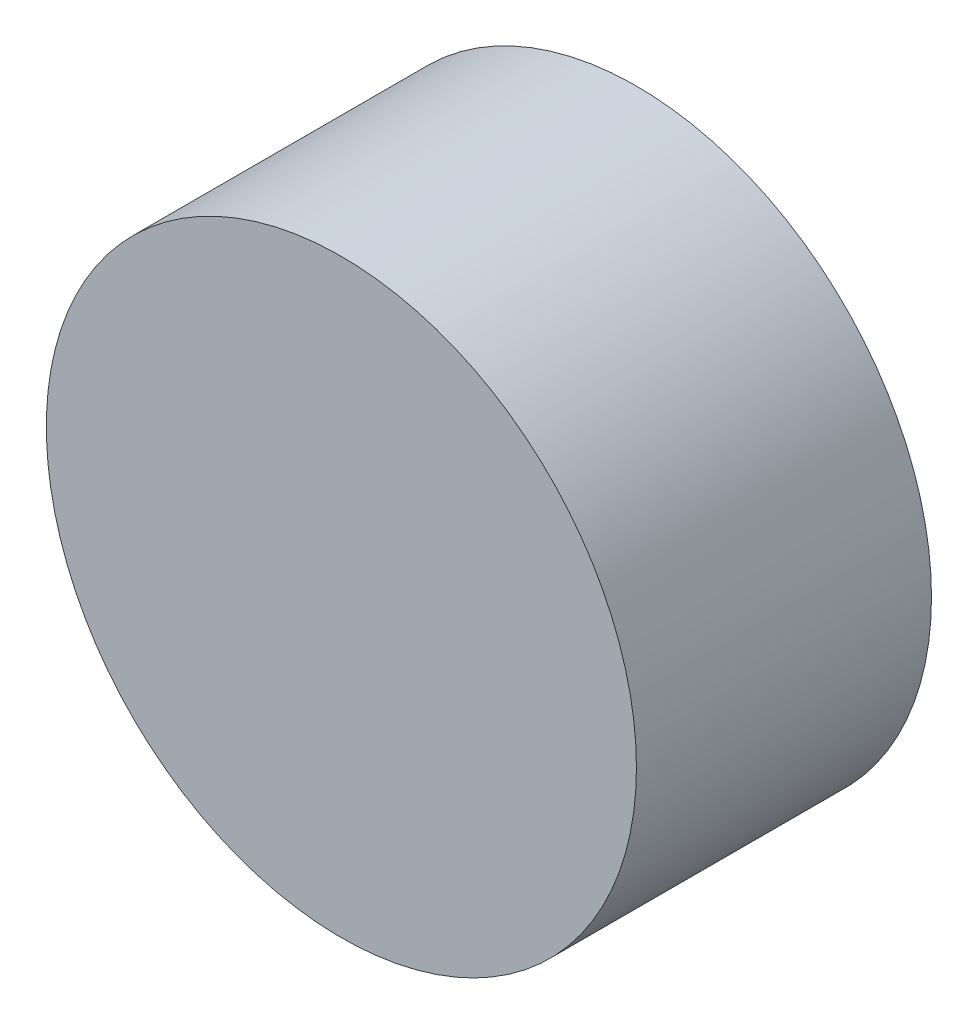
from build123d import *

# Parameters (mm, degrees)
SKETCH1_R    = 3
MAGNET_DEPTH = 3


with BuildPart() as part:
    # Sketch1 → Magnet (new body)
    with BuildSketch(Plane.XY):
        Circle(SKETCH1_R)
    extrude(amount=MAGNET_DEPTH)


solid = part.part
